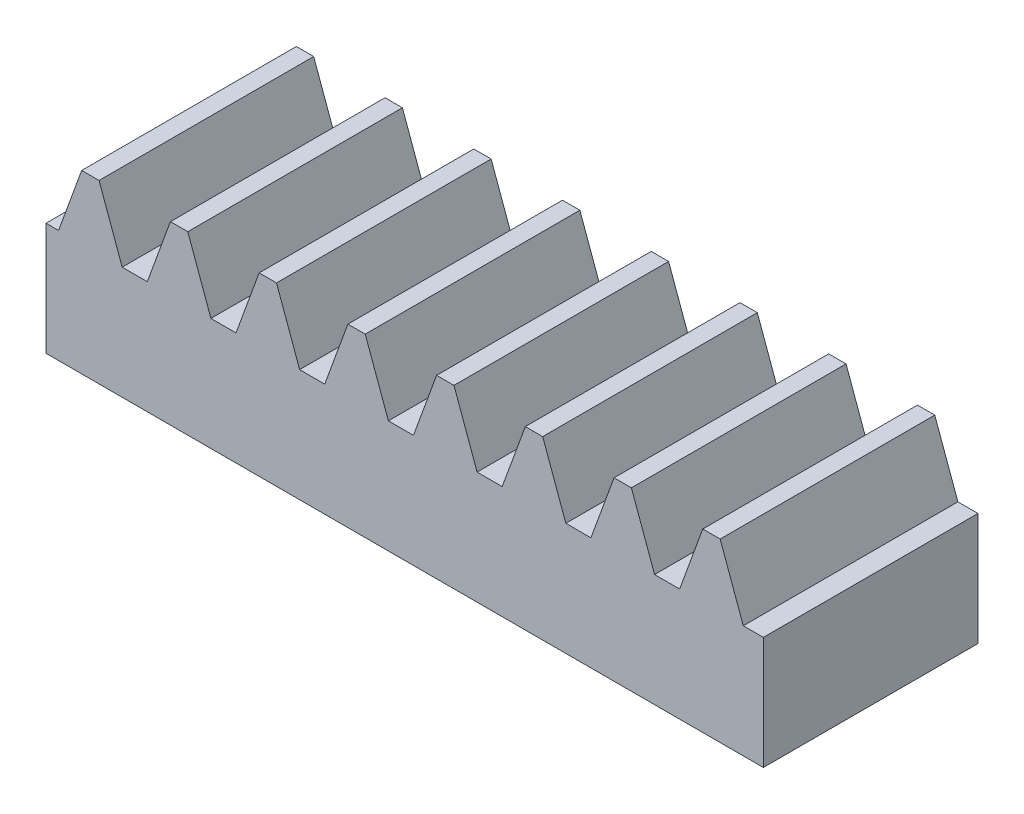
from build123d import *

# Parameters (mm, degrees)
BLANKSKE_W        = 12.7
BLANKSKE_H        = 3.12
BLANK_DEPTH       = 3.8
TOOTHCUTSIM_DEPTH = 14.618531492
TEETHCUTS_COUNT   = 9
TEETHCUTS_PITCH   = 1.570796325


with BuildPart() as part:
    # BlankSke → Blank (new body)
    with BuildSketch(Plane.XY):
        with Locations((6.35, 1.56)):
            Rectangle(BLANKSKE_W, BLANKSKE_H)
    extrude(amount=-BLANK_DEPTH)

    # TooCutSkeSim → ToothCutSim (cut, through all)
    with BuildSketch(Plane.XY):
        Polygon((0.222217685, 1.995), (-0.222217685, 1.995), (-0.640929042, 3.1454), (0.640929042, 3.1454), align=None)
    toothcutsim = extrude(amount=-TOOTHCUTSIM_DEPTH, mode=Mode.SUBTRACT)

    # TeethCuts: ToothCutSim ×9
    with Locations(*[(i * TEETHCUTS_PITCH, 0, 0) for i in range(1, TEETHCUTS_COUNT)]):
        add(toothcutsim, mode=Mode.SUBTRACT)


solid = part.part
